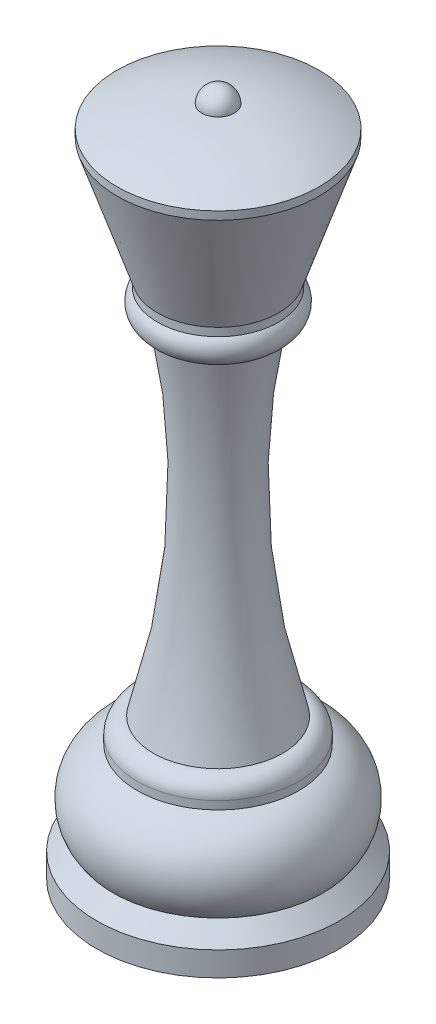
from build123d import *


with BuildPart() as part:
    # Sketch1 → Revolve1 (revolve)
    with BuildSketch(Plane.XY, mode=Mode.PRIVATE) as revolve1_sk:
        with BuildLine():
            Line((-15, 0), (0, 0))
            Line((0, 0), (0, 83))
            Line((0, 83), (-2, 83))
            ThreePointArc((-2, 83), (-7.394335397, 82.257693837), (-12.5, 80.365060283))
            Line((-12.5, 80.365060283), (-12.5, 79.365060283))
            Line((-12.5, 79.365060283), (-7.5, 64.365060283))
            Line((-7.5, 64.365060283), (-7.5, 63.365060283))
            ThreePointArc((-7.5, 63.365060283), (-8, 61.085924924), (-6, 59.884068865))
            ThreePointArc((-6, 59.884068865), (-4.460944967, 38.549386799), (-8, 17.454068865))
            ThreePointArc((-8, 17.454068865), (-9.414213562, 16.868282427), (-10, 15.454068865))
            Line((-10, 15.454068865), (-10, 14.454068865))
            ThreePointArc((-10, 14.454068865), (-14, 10.520343653), (-13, 5))
            Line((-13, 5), (-15, 3))
            Line((-15, 3), (-15, 0))
        make_face()
        with BuildLine():
            Line((-2, 83), (0, 83))
            Line((0, 83), (0, 85))
            ThreePointArc((0, 85), (-1.414213562, 84.414213562), (-2, 83))
        make_face()
    revolve(revolve1_sk.sketch.rotate(Axis((0, 0, 0), (0, 1, 0)), 270), axis=Axis((0, 0, 0), (0, 1, 0)))


solid = part.part
